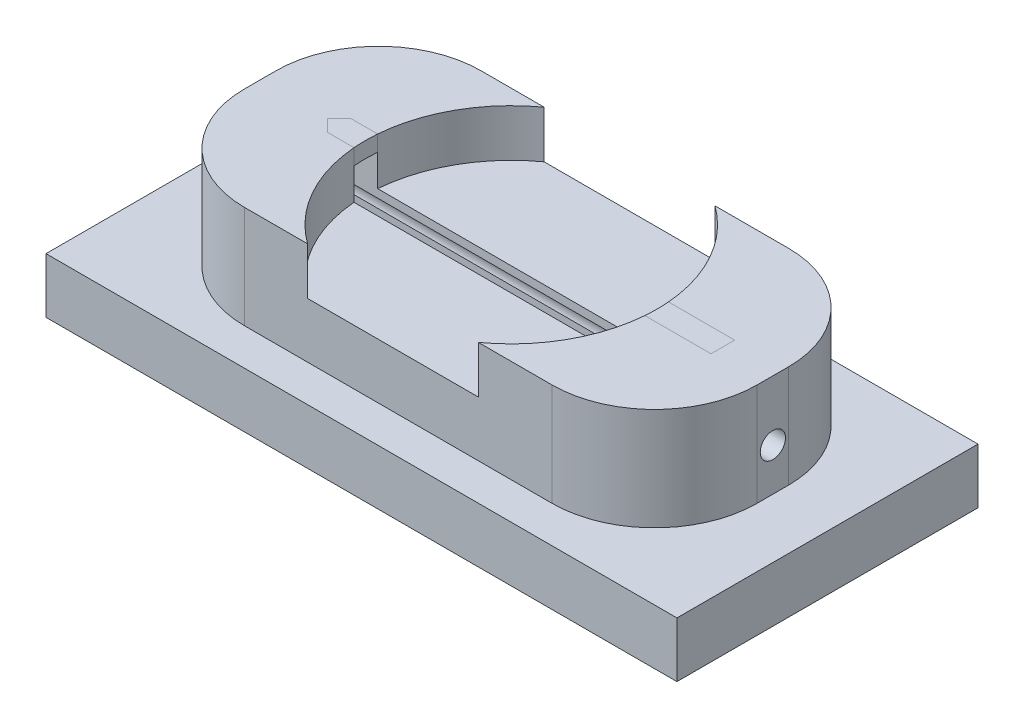
from build123d import *

# Parameters (mm, degrees)
SKETCH1_W                = 65
SKETCH1_H                = 30
BOSS_EXTRUDE1_DEPTH      = 58
CUT_EXTRUDE1_DEPTH       = 70
CUT_EXTRUDE2_DEPTH       = 89.396832522
CUT_EXTRUDE2_DEPTH_BACK  = 89.396832522
SKETCH3_R                = 1.6
FILLET1_R                = 13
SKETCH15_W               = 83.696095513
SKETCH15_H               = 31.69844841
CUT_EXTRUDE7_DEPTH       = 50
BOSS_EXTRUDE4_DEPTH      = 2
BOSS_EXTRUDE4_DEPTH_BACK = 5
SKETCH16_W               = 80
SKETCH16_H               = 38.173794917
SKETCH18_R               = 18.5
CUT_EXTRUDE8_DEPTH       = 6
BOSS_EXTRUDE5_DEPTH      = 2
BOSS_EXTRUDE5_2_DEPTH    = 2


with BuildPart() as part:
    # Sketch1 → Boss-Extrude1 (new body)
    with BuildSketch(Plane(origin=(0, 0, 0), x_dir=(1, 0, 0), z_dir=(0, 1, 0))):
        with Locations((7.5, 0)):
            Rectangle(SKETCH1_W, SKETCH1_H)
    extrude(amount=BOSS_EXTRUDE1_DEPTH)

    # Sketch2 → Cut-Extrude1 (cut)
    with BuildSketch(Plane(origin=(0, 58, 0), x_dir=(1, 0, 0), z_dir=(0, 1, 0))):
        Polygon((-15, 1.5), (15, 1.5), (33.657016573, 1.5), (33.657016573, -1.5), (15, -1.5), (-15, -1.5), (-16.5, 0), align=None)
    extrude(amount=-CUT_EXTRUDE1_DEPTH, mode=Mode.SUBTRACT)

    # Sketch3 → Cut-Extrude2 (cut, two sides: drawn at the far end of the back side and taken through both)
    with BuildSketch(Plane.ZY.offset(25).offset(-CUT_EXTRUDE2_DEPTH_BACK)):
        with Locations((0, 50.4)):
            Circle(SKETCH3_R)
    extrude(amount=CUT_EXTRUDE2_DEPTH + CUT_EXTRUDE2_DEPTH_BACK, mode=Mode.SUBTRACT)

    # Fillet1
    fillet1_edges = [part.edges().sort_by_distance(p)[0] for p in [
        (40, 29, 15),
        (-25, 29, 15),
        (-25, 29, -15),
        (40, 29, -15),
    ]]
    fillet(fillet1_edges, radius=FILLET1_R)

    # Sketch15 → Cut-Extrude7 (cut)
    with BuildSketch(Plane(origin=(0, -10, 0), x_dir=(-1, 0, 0), z_dir=(0, -1, 0))):
        with Locations((-0.057440767, 0.030479277)):
            Rectangle(SKETCH15_W, SKETCH15_H)
    extrude(amount=-CUT_EXTRUDE7_DEPTH, mode=Mode.SUBTRACT)

    # Sketch16 → Boss-Extrude4 (add, two sides: drawn at the far end of the back side and taken through both)
    with BuildSketch(Plane(origin=(0, 40, 0), x_dir=(-1, 0, 0), z_dir=(0, -1, 0)).offset(-BOSS_EXTRUDE4_DEPTH_BACK)):
        with Locations((-7.5, -0.575928298)):
            Rectangle(SKETCH16_W, SKETCH16_H)
    extrude(amount=BOSS_EXTRUDE4_DEPTH + BOSS_EXTRUDE4_DEPTH_BACK)

    # Sketch18 → Cut-Extrude8 (cut)
    with BuildSketch(Plane(origin=(0, 58, 0), x_dir=(1, 0, 0), z_dir=(0, 1, 0))):
        with Locations((6.828508286, 0)):
            Circle(SKETCH18_R)
    extrude(amount=-CUT_EXTRUDE8_DEPTH, mode=Mode.SUBTRACT)


with BuildPart() as body_2:
    # Sketch19 → Boss-Extrude5 (new body)
    with BuildSketch(Plane(origin=(0, 58, 0), x_dir=(1, 0, 0), z_dir=(0, 1, 0))):
        with BuildLine():
            Line((-11.610580628, 1.5), (-15, 1.5))
            Line((-15, 1.5), (-16.5, 0))
            Line((-16.5, 0), (-15, -1.5))
            Line((-15, -1.5), (-11.610580628, -1.5))
            ThreePointArc((-11.610580628, -1.5), (-11.671491714, 0), (-11.610580628, 1.5))
        make_face()
    extrude(amount=-BOSS_EXTRUDE5_DEPTH)


with BuildPart() as body_3:
    # Sketch19 → Boss-Extrude5 2 (new body)
    with BuildSketch(Plane(origin=(0, 58, 0), x_dir=(1, 0, 0), z_dir=(0, 1, 0))):
        with BuildLine():
            Line((25.267597201, 1.5), (33.657016573, 1.5))
            Line((33.657016573, 1.5), (33.657016573, -1.5))
            Line((33.657016573, -1.5), (25.267597201, -1.5))
            ThreePointArc((25.267597201, -1.5), (25.328508286, 0), (25.267597201, 1.5))
        make_face()
    extrude(amount=-BOSS_EXTRUDE5_2_DEPTH)


solid = Compound([part.part, body_2.part, body_3.part])
